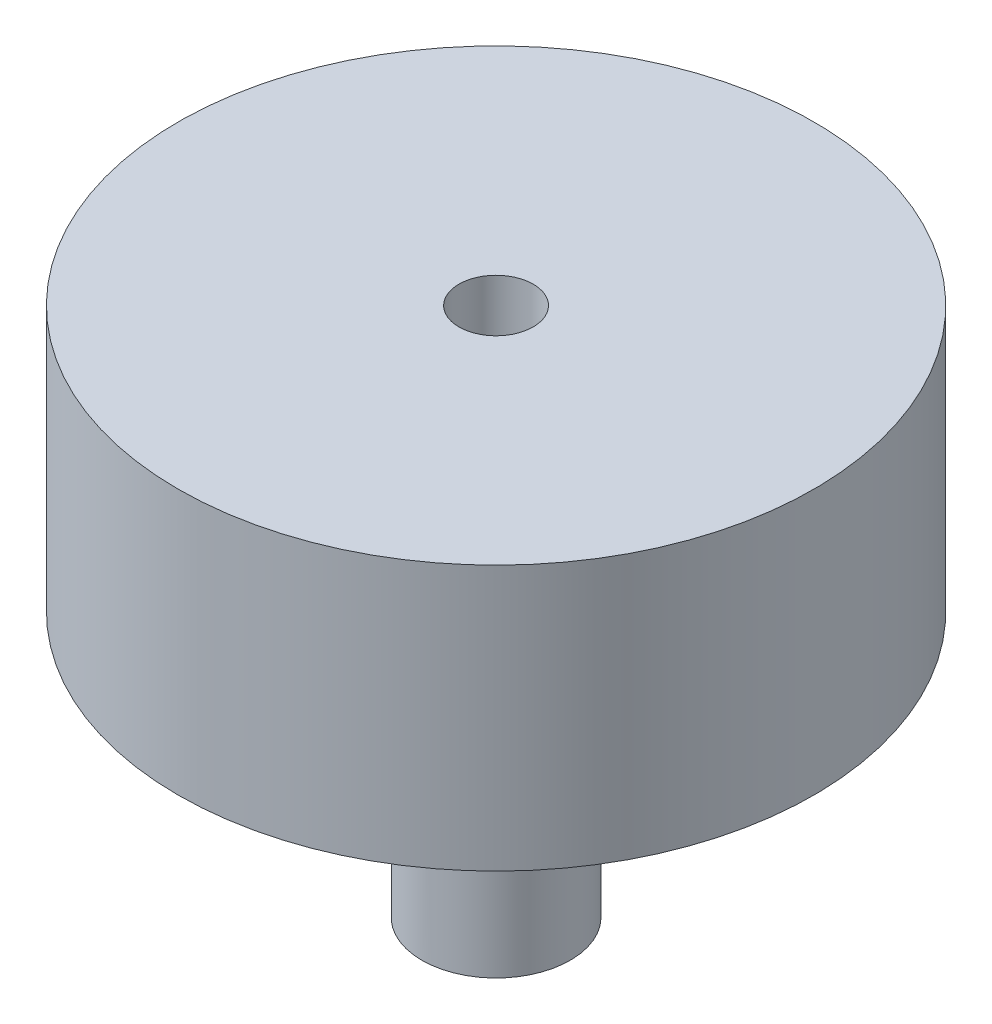
from build123d import *

# Parameters (mm, degrees)
SKETCH5_R           = 30
SKETCH5_R_2         = 7
BOSS_EXTRUDE5_DEPTH = 25
SKETCH5_6_R         = 7
BOSS_EXTRUDE6_DEPTH = 25
SKETCH5_8_R         = 3.5
CUT_EXTRUDE1_DEPTH  = 25
BOSS_EXTRUDE7_START = -25
SKETCH5_9_R         = 7
SKETCH5_9_R_2       = 3.5
BOSS_EXTRUDE7_DEPTH = 25


with BuildPart() as part:
    # Sketch5 → Boss-Extrude5 (new body)
    with BuildSketch(Plane(origin=(0, 0, 0), x_dir=(1, 0, 0), z_dir=(0, 1, 0))):
        Circle(SKETCH5_R)
        Circle(SKETCH5_R_2, mode=Mode.SUBTRACT)
    extrude(amount=BOSS_EXTRUDE5_DEPTH)

    # Sketch5<6> → Boss-Extrude6 (add)
    with BuildSketch(Plane(origin=(0, 0, 0), x_dir=(1, 0, 0), z_dir=(0, 1, 0))):
        Circle(SKETCH5_6_R)
    extrude(amount=BOSS_EXTRUDE6_DEPTH)

    # Sketch5<8> → Cut-Extrude1 (cut)
    with BuildSketch(Plane(origin=(0, 0, 0), x_dir=(1, 0, 0), z_dir=(0, 1, 0))):
        Circle(SKETCH5_8_R)
    extrude(amount=CUT_EXTRUDE1_DEPTH, mode=Mode.SUBTRACT)

    # Sketch5<9> → Boss-Extrude7 (add)
    with BuildSketch(Plane(origin=(0, 0, 0), x_dir=(1, 0, 0), z_dir=(0, 1, 0)).offset(BOSS_EXTRUDE7_START)):
        Circle(SKETCH5_9_R)
        Circle(SKETCH5_9_R_2, mode=Mode.SUBTRACT)
    extrude(amount=BOSS_EXTRUDE7_DEPTH)

    # Sketch9 → CBORE for M5 Hex Head Bolt1 (revolve, cut)
    with BuildSketch(Plane(origin=(0, -10.718846388, 10), x_dir=(0, -1, 0), z_dir=(1, 0, 0))):
        Polygon((0, 0), (0, 40), (2.75, 40), (2.75, 3.58), (6.12, 3.58), (6.12, 0.025), (6.145, 0), align=None)
    revolve(axis=Axis((0, -10.718846388, 16.35), (0, 0, -1)), mode=Mode.SUBTRACT)


solid = part.part
